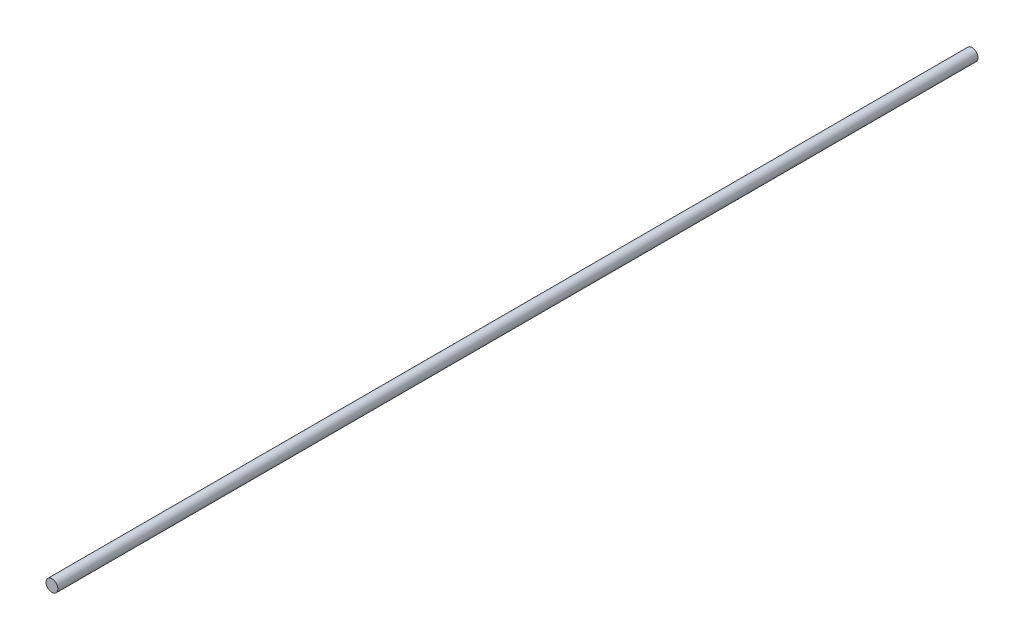
from build123d import *

# Parameters (mm, degrees)
SKETCH1_R           = 4
BOSS_EXTRUDE1_DEPTH = 620


with BuildPart() as part:
    # Sketch1 → Boss-Extrude1 (new body)
    with BuildSketch(Plane.XY):
        Circle(SKETCH1_R)
    extrude(amount=BOSS_EXTRUDE1_DEPTH)


solid = part.part
